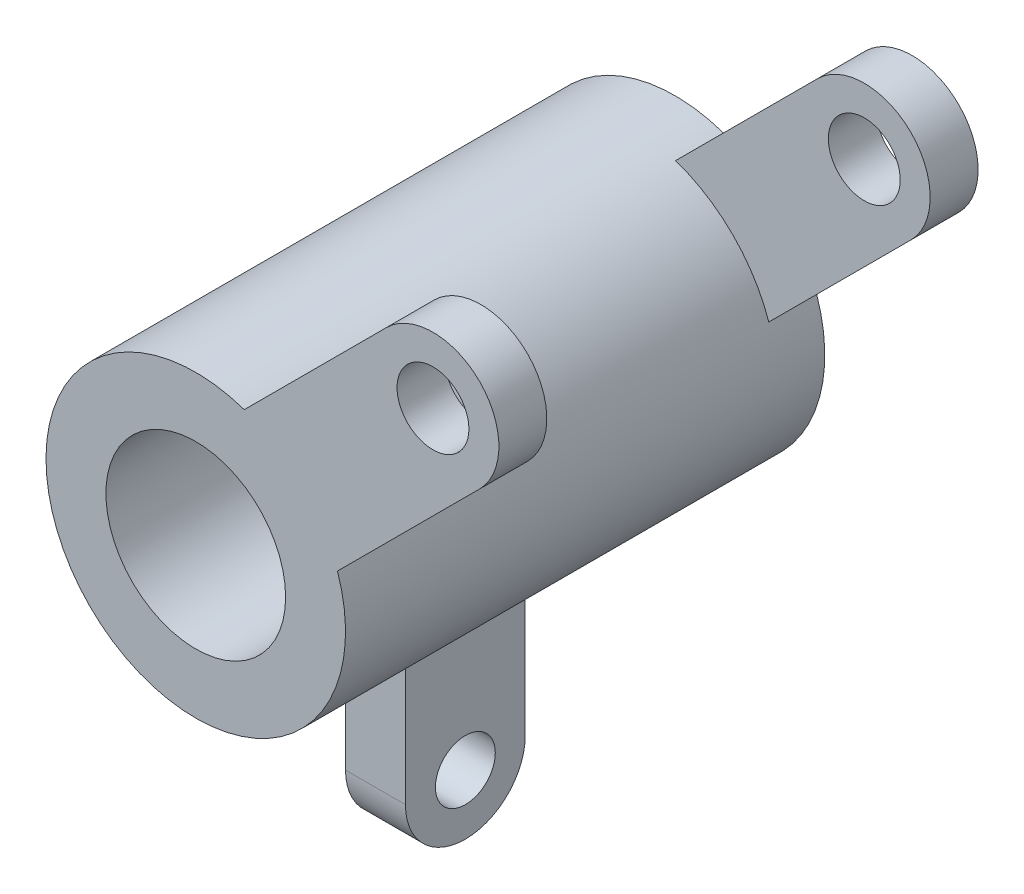
from build123d import *

# Parameters (mm, degrees)
SKETCH_1_R           = 12.5
SKETCH_1_R_2         = 7.5
EXTRUDE_1_DEPTH      = 40
SKETCH_1_4_R         = 3
EXTRUDE_3_DEPTH      = 4
EXTRUDE_4_DEPTH      = 2.5
EXTRUDE_4_DEPTH_BACK = 2.5
SKETCH_2_R           = 2.5


with BuildPart() as part:
    # Эскиз1 → Бобышка-Вытянуть1 (new body)
    with BuildSketch(Plane.XY):
        Circle(SKETCH_1_R)
        Circle(SKETCH_1_R_2, mode=Mode.SUBTRACT)
    extrude(amount=EXTRUDE_1_DEPTH)

    # Эскиз1<4> → Бобышка-Вытянуть3 (add)
    with BuildSketch(Plane.XY):
        with BuildLine():
            Line((15.909902577, 23.68807717), (4.048166637, 11.82634123))
            ThreePointArc((4.048166637, 11.82634123), (8.838834765, 8.838834765), (11.82634123, 4.048166637))
            Line((11.82634123, 4.048166637), (23.68807717, 15.909902577))
            ThreePointArc((23.68807717, 15.909902577), (23.68807717, 23.68807717), (15.909902577, 23.68807717))
        make_face()
        with Locations((19.798989873, 19.798989873)):
            Circle(SKETCH_1_4_R, mode=Mode.SUBTRACT)
    extrude_3 = extrude(amount=EXTRUDE_3_DEPTH)

    # Зеркальное отражение1: Бобышка-Вытянуть3 across plane
    add(extrude_3.mirror(Plane.XY.offset(20)))

    # Эскиз2 → Бобышка-Вытянуть4 (add, two sides: drawn at the far end of the back side and taken through both)
    with BuildSketch(Plane(origin=(0, 0, 0), x_dir=(0, 0, -1), z_dir=(1, 0, 0)).offset(-EXTRUDE_4_DEPTH_BACK)):
        with BuildLine():
            Line((-25, -12.5), (-25, -25))
            ThreePointArc((-25, -25), (-20, -30), (-15, -25))
            Line((-15, -25), (-15, -12.5))
            ThreePointArc((-15, -12.5), (-15.105468435, -11.478451782), (-15.417424305, -10.5))
            Line((-15.417424305, -10.5), (-24.582575695, -10.5))
            ThreePointArc((-24.582575695, -10.5), (-24.894531565, -11.478451782), (-25, -12.5))
        make_face()
        with Locations((-20, -25)):
            Circle(SKETCH_2_R, mode=Mode.SUBTRACT)
    extrude(amount=EXTRUDE_4_DEPTH + EXTRUDE_4_DEPTH_BACK)


solid = part.part
